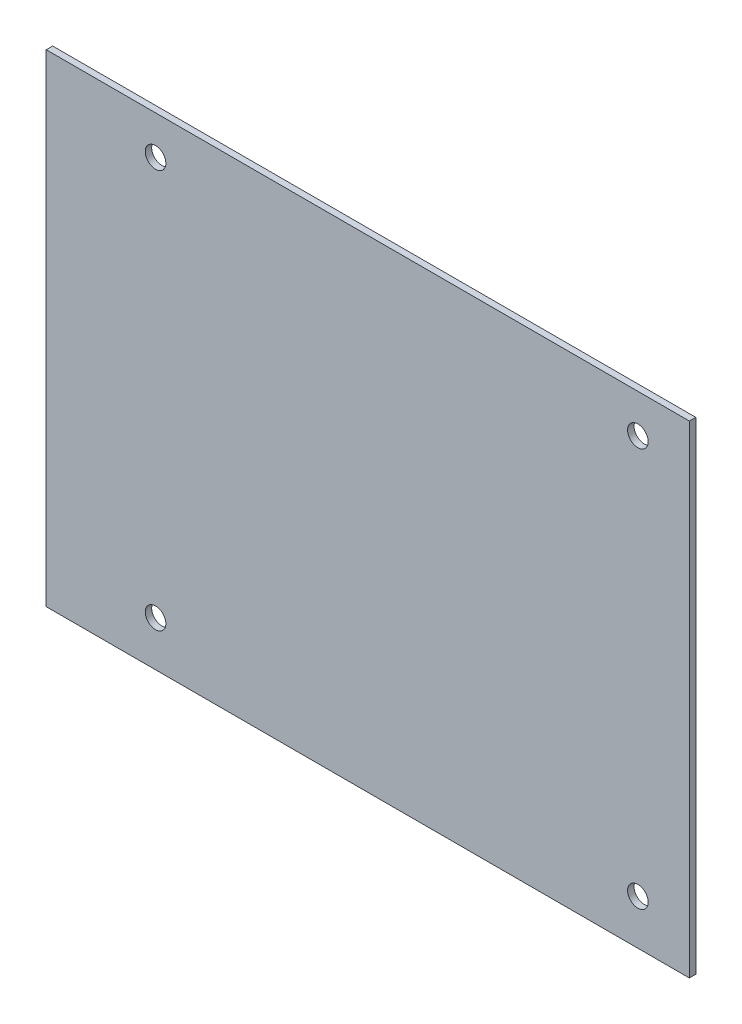
from build123d import *

# Parameters (mm, degrees)
SKETCH_1_W                  = 100
SKETCH_1_H                  = 75
EXTRUDE_1_DEPTH             = 1
SKETCH_2_R                  = 1.6
CUT_EXTRUDE_1_DEPTH         = 1
PATTERN_LINEAR_1_COUNT      = 2
PATTERN_LINEAR_1_PITCH      = 75
PATTERN_LINEAR_1_COUNT_DIR2 = 2
PATTERN_LINEAR_1_PITCH_DIR2 = 62


with BuildPart() as part:
    # ｽｹｯﾁ1 → ﾎﾞｽ - 押し出し1 (new body)
    with BuildSketch(Plane.XY):
        Rectangle(SKETCH_1_W, SKETCH_1_H)
    extrude(amount=EXTRUDE_1_DEPTH)

    # ｽｹｯﾁ2 → ｶｯﾄ - 押し出し1 (cut)
    with BuildSketch(Plane.XY.offset(1)):
        with Locations((42, -30.5)):
            Circle(SKETCH_2_R)
    cut_extrude_1 = extrude(amount=-CUT_EXTRUDE_1_DEPTH, mode=Mode.SUBTRACT)

    # 直線ﾊﾟﾀｰﾝ1: Cut-Extrude 1 2 × 2
    with Locations(*[(-i * PATTERN_LINEAR_1_PITCH, j * PATTERN_LINEAR_1_PITCH_DIR2, 0) for i in range(PATTERN_LINEAR_1_COUNT) for j in range(PATTERN_LINEAR_1_COUNT_DIR2) if (i, j) != (0, 0)]):
        add(cut_extrude_1, mode=Mode.SUBTRACT)


solid = part.part
